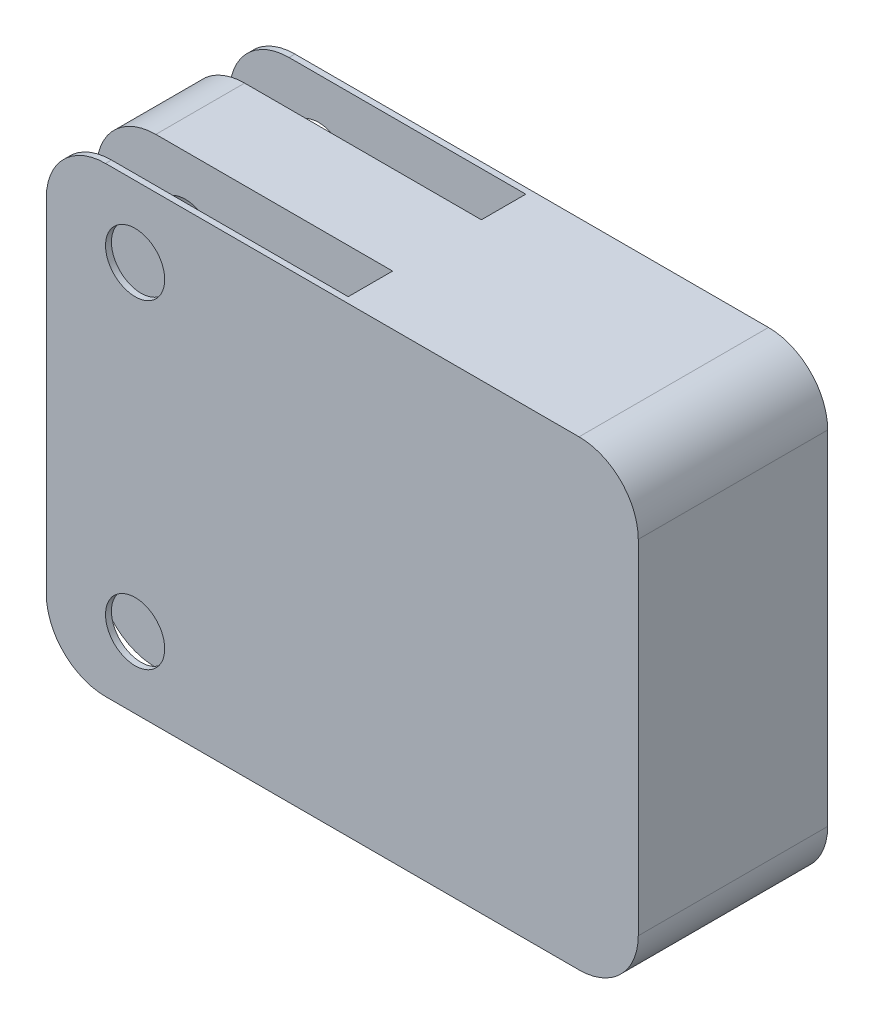
from build123d import *

# Parameters (mm, degrees)
SKETCH1_W           = 78
SKETCH1_H           = 100
SKETCH1_R           = 5
BOSS_EXTRUDE1_DEPTH = 15
FILLET1_R           = 10
SKETCH2_W           = 78
SKETCH2_H           = 7.5
BOSS_EXTRUDE2_DEPTH = 50
SKETCH3_W           = 78
SKETCH3_H           = 1
BOSS_EXTRUDE3_DEPTH = 100
FILLET2_R           = 10
FILLET3_R           = 10
CUT_EXTRUDE1_START  = -100
SKETCH4_R           = 5
CUT_EXTRUDE1_DEPTH  = 100


with BuildPart() as part:
    # Sketch1 → Boss-Extrude1 (new body)
    with BuildSketch(Plane(origin=(0, 0, 0), x_dir=(0, 1, 0), z_dir=(0, 0, 1))):
        with Locations((0, 5)):
            Rectangle(SKETCH1_W, SKETCH1_H)
        with Locations(Location((-27, 40, 0), (0, 0, 270))):
            Circle(SKETCH1_R, mode=Mode.SUBTRACT)
        with Locations(Location((27, 40, 0), (0, 0, 90))):
            Circle(SKETCH1_R, mode=Mode.SUBTRACT)
    extrude(amount=BOSS_EXTRUDE1_DEPTH)

    # Fillet1
    fillet1_edges = [part.edges().sort_by_distance(p)[0] for p in [
        (-55, -39, 7.5),
        (-55, 39, 7.5),
    ]]
    fillet(fillet1_edges, radius=FILLET1_R)

    # Sketch2 → Boss-Extrude2 (add)
    with BuildSketch(Plane.YZ.offset(45)):
        with Locations((0, 18.75)):
            Rectangle(SKETCH2_W, SKETCH2_H)
        with Locations((0, -3.75)):
            Rectangle(SKETCH2_W, SKETCH2_H)
    extrude(amount=-BOSS_EXTRUDE2_DEPTH)

    # Sketch3 → Boss-Extrude3 (add)
    with BuildSketch(Plane.YZ.offset(45)):
        with Locations((0, 23)):
            Rectangle(SKETCH3_W, SKETCH3_H)
        with Locations((0, -8)):
            Rectangle(SKETCH3_W, SKETCH3_H)
    extrude(amount=-BOSS_EXTRUDE3_DEPTH)

    # Fillet2
    fillet2_edges = [part.edges().sort_by_distance(p)[0] for p in [
        (-55, 39, -8),
        (-55, -39, -8),
        (45, 39, 7.5),
        (45, -39, 7.5),
    ]]
    fillet(fillet2_edges, radius=FILLET2_R)

    # Fillet3
    fillet3_edges = [part.edges().sort_by_distance(p)[0] for p in [
        (-55, -39, 23),
        (-55, 39, 23),
    ]]
    fillet(fillet3_edges, radius=FILLET3_R)

    # Sketch4 → Cut-Extrude1 (cut)
    with BuildSketch(Plane.XY.offset(23.5).offset(CUT_EXTRUDE1_START)):
        with Locations(Location((-40, 27, 0), (0, 0, 180))):
            Circle(SKETCH4_R)
        with Locations((-40, -27)):
            Circle(SKETCH4_R)
    extrude(amount=CUT_EXTRUDE1_DEPTH, mode=Mode.SUBTRACT)


solid = part.part
